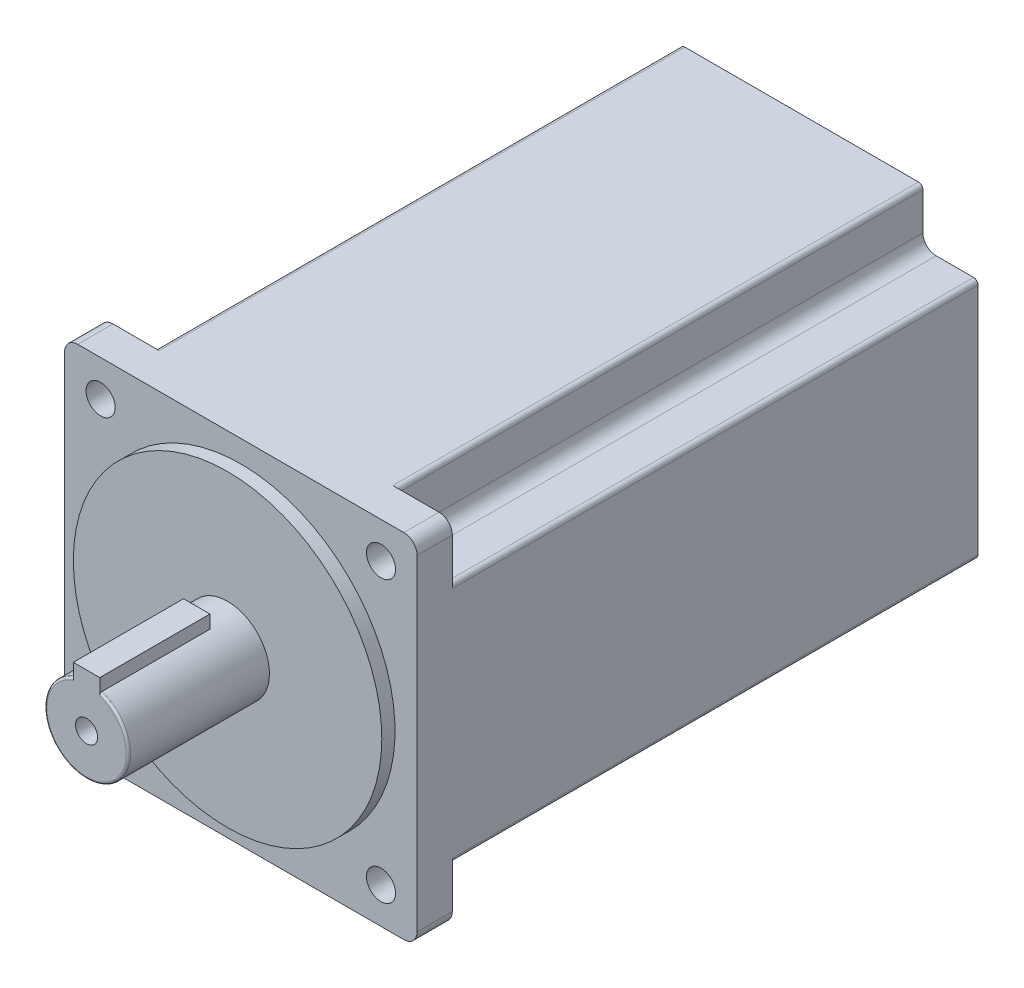
from build123d import *

# Parameters (mm, degrees)
SKETCH_1_W              = 80
SKETCH_1_H              = 80
EXTRUDE_1_DEPTH         = 8
FILLET_1_R              = 3
HOLE_WIZARD_6_6_6_6_1_D = 6.6
SKETCH_5_R              = 35
EXTRUDE_2_DEPTH         = 3
SKETCH_6_R              = 9.5
EXTRUDE_3_DEPTH         = 32
EXTRUDE_4_DEPTH         = 119.3
FILLET_2_R              = 3
FILLET_3_R              = 1
SKETCH_8_W              = 6
SKETCH_8_H              = 6
EXTRUDE_5_DEPTH         = 25
FILLET_4_R              = 0.5
SKETCH_9_R              = 2.5
CUT_EXTRUDE_1_DEPTH     = 10


with BuildPart() as part:
    # 草图1 → 凸台-拉伸1 (new body)
    with BuildSketch(Plane.XY):
        Rectangle(SKETCH_1_W, SKETCH_1_H)
    extrude(amount=EXTRUDE_1_DEPTH)

    # 圆角1
    fillet_1_edges = [part.edges().sort_by_distance(p)[0] for p in [
        (40, -40, 4),
        (-40, -40, 4),
        (-40, 40, 4),
        (40, 40, 4),
    ]]
    fillet(fillet_1_edges, radius=FILLET_1_R)

    # Ø6.6 (6.6) 直径孔1 (through all)
    with Locations(Plane.XY.offset(8)):
        with Locations((31.819805153, 31.819805153), (31.819805153, -31.819805153), (-31.819805153, -31.819805153), (-31.819805153, 31.819805153)):
            Hole(HOLE_WIZARD_6_6_6_6_1_D / 2)

    # 草图5 → 凸台-拉伸2 (add)
    with BuildSketch(Plane.XY.offset(8)):
        with Locations(Location((0, 0, 0), (0, 0, 180))):
            Circle(SKETCH_5_R)
    extrude(amount=EXTRUDE_2_DEPTH)

    # 草图6 → 凸台-拉伸3 (add)
    with BuildSketch(Plane.XY.offset(11)):
        Circle(SKETCH_6_R)
    extrude(amount=EXTRUDE_3_DEPTH)

    # 草图7 → 凸台-拉伸4 (add)
    with BuildSketch(Plane(origin=(0, 0, 0), x_dir=(-1, 0, 0), z_dir=(0, 0, -1))):
        Polygon((-27.5, 40), (27.5, 40), (27.5, 27.5), (40, 27.5), (40, -27.5), (27.5, -27.5), (27.5, -40), (-27.5, -40), (-27.5, -27.5), (-40, -27.5), (-40, 27.5), (-27.5, 27.5), align=None)
    extrude(amount=EXTRUDE_4_DEPTH)

    # 圆角2
    fillet_2_edges = [part.edges().sort_by_distance(p)[0] for p in [
        (27.5, -27.5, -59.65),
        (-27.5, -27.5, -59.65),
        (-27.5, 27.5, -59.65),
        (27.5, 27.5, -59.65),
    ]]
    fillet(fillet_2_edges, radius=FILLET_2_R)

    # 圆角3
    fillet_3_edges = [part.edges().sort_by_distance(p)[0] for p in [
        (40, -27.5, -59.65),
        (27.5, -40, -59.65),
        (-27.5, -40, -59.65),
        (-40, -27.5, -59.65),
        (-40, 27.5, -59.65),
        (-27.5, 40, -59.65),
        (27.5, 40, -59.65),
        (40, 27.5, -59.65),
    ]]
    fillet(fillet_3_edges, radius=FILLET_3_R)

    # 草图8 → 凸台-拉伸5 (add)
    with BuildSketch(Plane.XY.offset(43)):
        with Locations((0, 9)):
            Rectangle(SKETCH_8_W, SKETCH_8_H)
    extrude(amount=-EXTRUDE_5_DEPTH)

    # 圆角4
    fillet_4_edges = [part.edges().sort_by_distance(p)[0] for p in [
        (-5.556527693, -7.705517504, 43),
    ]]
    fillet(fillet_4_edges, radius=FILLET_4_R)

    # 草图9 → 切除-拉伸1 (cut)
    with BuildSketch(Plane.XY.offset(43)):
        Circle(SKETCH_9_R)
    extrude(amount=-CUT_EXTRUDE_1_DEPTH, mode=Mode.SUBTRACT)


solid = part.part
